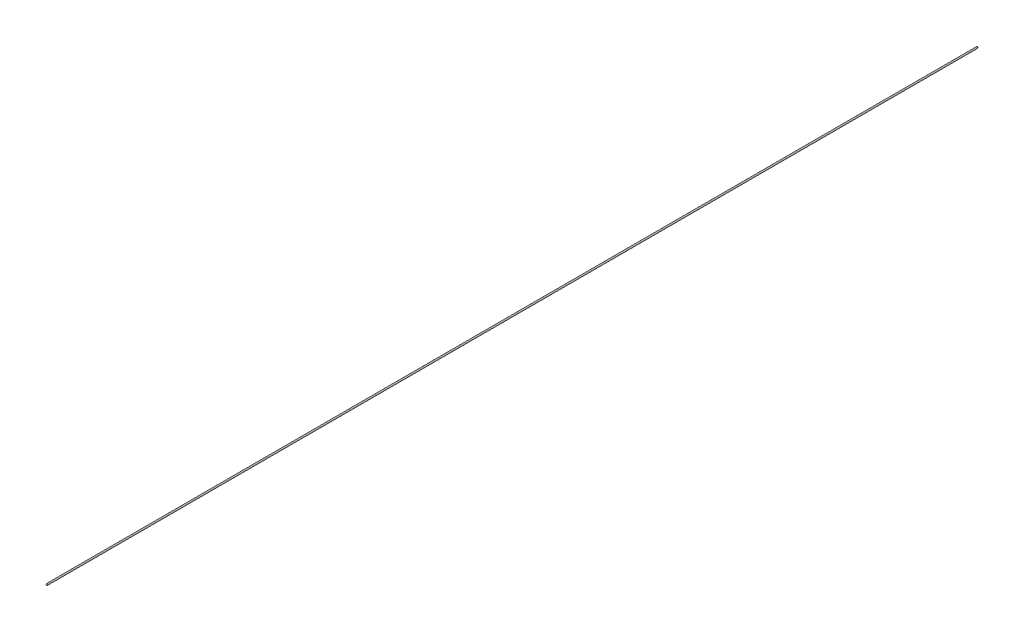
from build123d import *

# Parameters (mm, degrees)
SKETCH_2_R      = 25
EXTRUDE_1_DEPTH = 31100


with BuildPart() as part:
    # 草图2 → 凸台-拉伸1 (new body)
    with BuildSketch(Plane.XY):
        Circle(SKETCH_2_R)
    extrude(amount=EXTRUDE_1_DEPTH)

    # 草图7 → 旋转2 (revolve)
    with BuildSketch(Plane(origin=(0, 0, 0), x_dir=(0, 0, -1), z_dir=(1, 0, 0))):
        with BuildLine():
            Line((-31100, 25), (-31100, 0))
            Line((-31100, 0), (-31125, 0))
            ThreePointArc((-31125, 0), (-31117.67766953, 17.67766953), (-31100, 25))
        make_face()
    revolve(axis=Axis((0, 0, 21000), (0, 0, -1)))

    # 草图8 → 旋转3 (revolve)
    with BuildSketch(Plane(origin=(0, 0, 0), x_dir=(0, 0, -1), z_dir=(1, 0, 0))):
        with BuildLine():
            Line((25, 0), (0, 0))
            Line((0, 0), (0, 25))
            ThreePointArc((0, 25), (17.67766953, 17.67766953), (25, 0))
        make_face()
    revolve(axis=Axis((0, 0, -25), (0, 0, 1)))


solid = part.part
